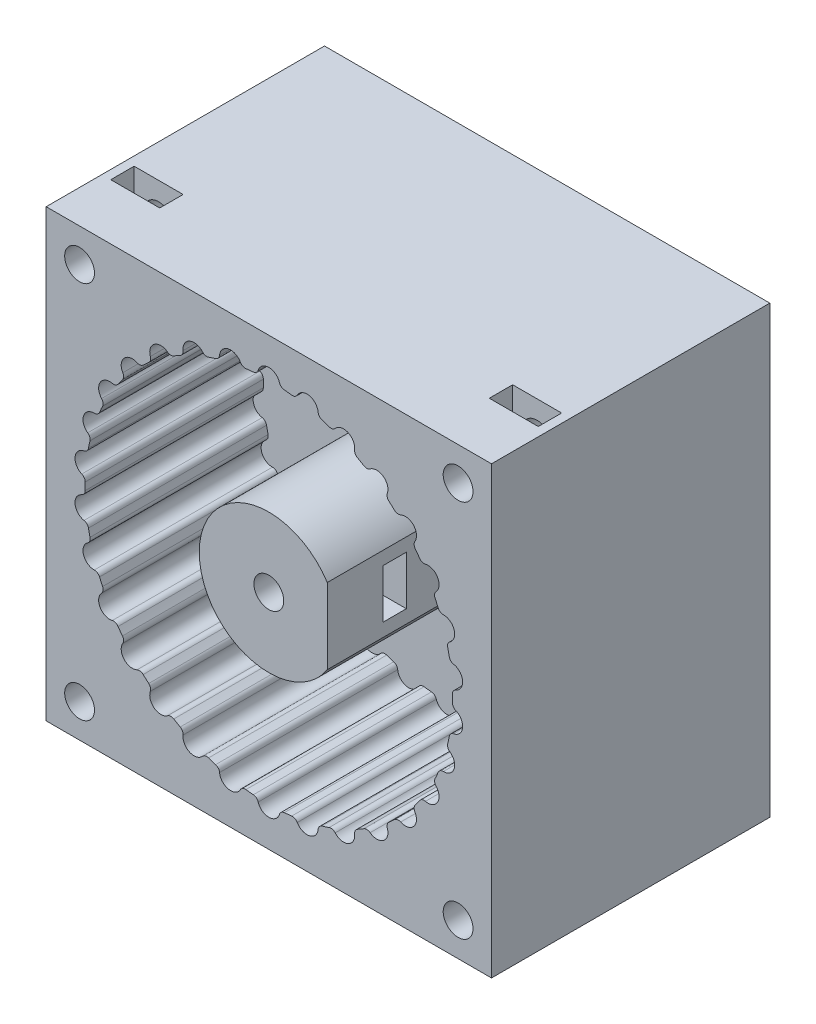
from build123d import *

# Parameters (mm, degrees)
SKETCH1_W                = 50.8
SKETCH1_H                = 50.8
BOSS_EXTRUDE1_DEPTH      = 31.75
CUT_EXTRUDE1_DEPTH       = 20.32
BOSS_EXTRUDE2_DEPTH      = 20.32
M3_CLEARANCE_HOLE1_D     = 3.4
M3_CLEARANCE_HOLE1_DEPTH = 25.4
M3_CLEARANCE_HOLE1_TIP   = 1.021463052
CUT_EXTRUDE2_DEPTH       = 2.667


with BuildPart() as part:
    # Sketch1 → Boss-Extrude1 (new body)
    with BuildSketch(Plane(origin=(0, 0, 0), x_dir=(0, 1, 0), z_dir=(0, 0, 1))):
        Rectangle(SKETCH1_W, SKETCH1_H)
    extrude(amount=BOSS_EXTRUDE1_DEPTH)

    # Sketch2 → Cut-Extrude1 (cut)
    with BuildSketch(Plane.XY.offset(31.75)):
        with BuildLine():
            ThreePointArc((20.950701772, 0.424405759), (21.052431234, 0.782210639), (21.337116454, 1.021642342))
            ThreePointArc((21.337116454, 1.021642342), (22.103249125, 2.323145096), (21.083260653, 3.436918953))
            ThreePointArc((21.083260653, 3.436918953), (20.755015837, 3.611929114), (20.581117591, 3.940764355))
            ThreePointArc((20.581117591, 3.940764355), (20.497082973, 4.356789481), (20.404639753, 4.771027304))
            ThreePointArc((20.404639753, 4.771027304), (20.429754364, 5.142164033), (20.65843788, 5.435552965))
            ThreePointArc((20.65843788, 5.435552965), (21.137231075, 6.8679027), (19.907965193, 7.745270399))
            ThreePointArc((19.907965193, 7.745270399), (19.550506655, 7.848210232), (19.312039812, 8.133704156))
            ThreePointArc((19.312039812, 8.133704156), (19.143345065, 8.523166356), (18.966797065, 8.909132062))
            ThreePointArc((18.966797065, 8.909132062), (18.914199196, 9.277380185), (19.07688644, 9.611903841))
            ThreePointArc((19.07688644, 9.611903841), (19.247414599, 11.1125), (17.862596124, 11.715116361))
            ThreePointArc((17.862596124, 11.715116361), (17.491546519, 11.741486904), (17.198933224, 11.971162056))
            ThreePointArc((17.198933224, 11.971162056), (16.952951117, 12.317039962), (16.700014332, 12.657864998))
            ThreePointArc((16.700014332, 12.657864998), (16.572002763, 13.007130304), (16.661583521, 13.368168395))
            ThreePointArc((16.661583521, 13.368168395), (16.516393746, 14.871427726), (15.036545891, 15.172955524))
            ThreePointArc((15.036545891, 15.172955524), (14.668121865, 15.121604256), (14.334150724, 15.28542273))
            ThreePointArc((14.334150724, 15.28542273), (14.021631856, 15.572599818), (13.703360837, 15.853388495))
            ThreePointArc((13.703360837, 15.853388495), (13.505530288, 16.168406414), (13.518089451, 16.540179844))
            ThreePointArc((13.518089451, 16.540179844), (13.063527232, 17.9804027), (11.553326449, 17.967663722))
            ThreePointArc((11.553326449, 17.967663722), (11.203629901, 17.84083494), (10.842897055, 17.931637083))
            ThreePointArc((10.842897055, 17.931637083), (10.4775, 18.147562336), (10.107804718, 18.356042841))
            ThreePointArc((10.107804718, 18.356042841), (9.848801332, 18.623045579), (9.783790005, 18.989306064))
            ThreePointArc((9.783790005, 18.989306064), (9.039721892, 20.303547796), (7.565171202, 19.977098797))
            ThreePointArc((7.565171202, 19.977098797), (7.249485549, 19.780335528), (6.877756754, 19.79415285))
            ThreePointArc((6.877756754, 19.79415285), (6.475451117, 19.929389299), (6.070489029, 20.056450033))
            ThreePointArc((6.070489029, 20.056450033), (5.761632499, 20.263768289), (5.621891989, 20.608508489))
            ThreePointArc((5.621891989, 20.608508489), (4.620837328, 21.739330426), (3.246381672, 21.113438794))
            ThreePointArc((3.246381672, 21.113438794), (2.978503892, 20.855340536), (2.61202548, 20.791569154))
            ThreePointArc((2.61202548, 20.791569154), (2.190393948, 20.840206317), (1.767863841, 20.880294118))
            ThreePointArc((1.767863841, 20.880294118), (1.422652678, 21.018867089), (1.214290315, 21.327020202))
            ThreePointArc((1.214290315, 21.327020202), (0, 22.225), (-1.214290315, 21.327020202))
            ThreePointArc((-1.214290315, 21.327020202), (-1.422652678, 21.018867089), (-1.767863841, 20.880294118))
            ThreePointArc((-1.767863841, 20.880294118), (-2.190393948, 20.840206317), (-2.61202548, 20.791569154))
            ThreePointArc((-2.61202548, 20.791569154), (-2.978503892, 20.855340536), (-3.246381672, 21.113438794))
            ThreePointArc((-3.246381672, 21.113438794), (-4.620837328, 21.739330426), (-5.621891989, 20.608508489))
            ThreePointArc((-5.621891989, 20.608508489), (-5.761632499, 20.263768289), (-6.070489029, 20.056450033))
            ThreePointArc((-6.070489029, 20.056450033), (-6.475451117, 19.929389299), (-6.877756754, 19.79415285))
            ThreePointArc((-6.877756754, 19.79415285), (-7.249485549, 19.780335528), (-7.565171202, 19.977098797))
            ThreePointArc((-7.565171202, 19.977098797), (-9.039721892, 20.303547796), (-9.783790005, 18.989306064))
            ThreePointArc((-9.783790005, 18.989306064), (-9.848801332, 18.623045579), (-10.107804718, 18.356042841))
            ThreePointArc((-10.107804718, 18.356042841), (-10.4775, 18.147562336), (-10.842897055, 17.931637083))
            ThreePointArc((-10.842897055, 17.931637083), (-11.203629901, 17.84083494), (-11.553326449, 17.967663722))
            ThreePointArc((-11.553326449, 17.967663722), (-13.063527232, 17.9804027), (-13.518089451, 16.540179844))
            ThreePointArc((-13.518089451, 16.540179844), (-13.505530288, 16.168406414), (-13.703360837, 15.853388495))
            ThreePointArc((-13.703360837, 15.853388495), (-14.021631856, 15.572599818), (-14.334150724, 15.28542273))
            ThreePointArc((-14.334150724, 15.28542273), (-14.668121865, 15.121604256), (-15.036545891, 15.172955524))
            ThreePointArc((-15.036545891, 15.172955524), (-16.516393746, 14.871427726), (-16.661583521, 13.368168395))
            ThreePointArc((-16.661583521, 13.368168395), (-16.572002763, 13.007130304), (-16.700014332, 12.657864998))
            ThreePointArc((-16.700014332, 12.657864998), (-16.952951117, 12.317039962), (-17.198933224, 11.971162056))
            ThreePointArc((-17.198933224, 11.971162056), (-17.491546519, 11.741486904), (-17.862596124, 11.715116361))
            ThreePointArc((-17.862596124, 11.715116361), (-19.247414599, 11.1125), (-19.07688644, 9.611903841))
            ThreePointArc((-19.07688644, 9.611903841), (-18.914199196, 9.277380185), (-18.966797065, 8.909132062))
            ThreePointArc((-18.966797065, 8.909132062), (-19.143345065, 8.523166356), (-19.312039812, 8.133704156))
            ThreePointArc((-19.312039812, 8.133704156), (-19.550506655, 7.848210232), (-19.907965193, 7.745270399))
            ThreePointArc((-19.907965193, 7.745270399), (-21.137231075, 6.8679027), (-20.65843788, 5.435552965))
            ThreePointArc((-20.65843788, 5.435552965), (-20.429754364, 5.142164033), (-20.404639753, 4.771027304))
            ThreePointArc((-20.404639753, 4.771027304), (-20.497082973, 4.356789481), (-20.581117591, 3.940764355))
            ThreePointArc((-20.581117591, 3.940764355), (-20.755015837, 3.611929114), (-21.083260653, 3.436918953))
            ThreePointArc((-21.083260653, 3.436918953), (-22.103249125, 2.323145096), (-21.337116454, 1.021642342))
            ThreePointArc((-21.337116454, 1.021642342), (-21.052431234, 0.782210639), (-20.950701772, 0.424405759))
            ThreePointArc((-20.950701772, 0.424405759), (-20.955, 0), (-20.950701772, -0.424405759))
            ThreePointArc((-20.950701772, -0.424405759), (-21.052431234, -0.782210639), (-21.337116454, -1.021642342))
            ThreePointArc((-21.337116454, -1.021642342), (-22.103249125, -2.323145096), (-21.083260653, -3.436918953))
            ThreePointArc((-21.083260653, -3.436918953), (-20.755015837, -3.611929114), (-20.581117591, -3.940764355))
            ThreePointArc((-20.581117591, -3.940764355), (-20.497082973, -4.356789481), (-20.404639753, -4.771027304))
            ThreePointArc((-20.404639753, -4.771027304), (-20.429754364, -5.142164033), (-20.65843788, -5.435552965))
            ThreePointArc((-20.65843788, -5.435552965), (-21.137231075, -6.8679027), (-19.907965193, -7.745270399))
            ThreePointArc((-19.907965193, -7.745270399), (-19.550506655, -7.848210232), (-19.312039812, -8.133704156))
            ThreePointArc((-19.312039812, -8.133704156), (-19.143345065, -8.523166356), (-18.966797065, -8.909132062))
            ThreePointArc((-18.966797065, -8.909132062), (-18.914199196, -9.277380185), (-19.07688644, -9.611903841))
            ThreePointArc((-19.07688644, -9.611903841), (-19.247414599, -11.1125), (-17.862596124, -11.715116361))
            ThreePointArc((-17.862596124, -11.715116361), (-17.491546519, -11.741486904), (-17.198933224, -11.971162056))
            ThreePointArc((-17.198933224, -11.971162056), (-16.952951117, -12.317039962), (-16.700014332, -12.657864998))
            ThreePointArc((-16.700014332, -12.657864998), (-16.572002763, -13.007130304), (-16.661583521, -13.368168395))
            ThreePointArc((-16.661583521, -13.368168395), (-16.516393746, -14.871427726), (-15.036545891, -15.172955524))
            ThreePointArc((-15.036545891, -15.172955524), (-14.668121865, -15.121604256), (-14.334150724, -15.28542273))
            ThreePointArc((-14.334150724, -15.28542273), (-14.021631856, -15.572599818), (-13.703360837, -15.853388495))
            ThreePointArc((-13.703360837, -15.853388495), (-13.505530288, -16.168406414), (-13.518089451, -16.540179844))
            ThreePointArc((-13.518089451, -16.540179844), (-13.063527232, -17.9804027), (-11.553326449, -17.967663722))
            ThreePointArc((-11.553326449, -17.967663722), (-11.203629901, -17.84083494), (-10.842897055, -17.931637083))
            ThreePointArc((-10.842897055, -17.931637083), (-10.4775, -18.147562336), (-10.107804718, -18.356042841))
            ThreePointArc((-10.107804718, -18.356042841), (-9.848801332, -18.623045579), (-9.783790005, -18.989306064))
            ThreePointArc((-9.783790005, -18.989306064), (-9.039721892, -20.303547796), (-7.565171202, -19.977098797))
            ThreePointArc((-7.565171202, -19.977098797), (-7.249485549, -19.780335528), (-6.877756754, -19.79415285))
            ThreePointArc((-6.877756754, -19.79415285), (-6.475451117, -19.929389299), (-6.070489029, -20.056450033))
            ThreePointArc((-6.070489029, -20.056450033), (-5.761632499, -20.263768289), (-5.621891989, -20.608508489))
            ThreePointArc((-5.621891989, -20.608508489), (-4.620837328, -21.739330426), (-3.246381672, -21.113438794))
            ThreePointArc((-3.246381672, -21.113438794), (-2.978503892, -20.855340536), (-2.61202548, -20.791569154))
            ThreePointArc((-2.61202548, -20.791569154), (-2.190393948, -20.840206317), (-1.767863841, -20.880294118))
            ThreePointArc((-1.767863841, -20.880294118), (-1.422652678, -21.018867089), (-1.214290315, -21.327020202))
            ThreePointArc((-1.214290315, -21.327020202), (0, -22.225), (1.214290315, -21.327020202))
            ThreePointArc((1.214290315, -21.327020202), (1.422652678, -21.018867089), (1.767863841, -20.880294118))
            ThreePointArc((1.767863841, -20.880294118), (2.190393948, -20.840206317), (2.61202548, -20.791569154))
            ThreePointArc((2.61202548, -20.791569154), (2.978503892, -20.855340536), (3.246381672, -21.113438794))
            ThreePointArc((3.246381672, -21.113438794), (4.620837328, -21.739330426), (5.621891989, -20.608508489))
            ThreePointArc((5.621891989, -20.608508489), (5.761632499, -20.263768289), (6.070489029, -20.056450033))
            ThreePointArc((6.070489029, -20.056450033), (6.475451117, -19.929389299), (6.877756754, -19.79415285))
            ThreePointArc((6.877756754, -19.79415285), (7.249485549, -19.780335528), (7.565171202, -19.977098797))
            ThreePointArc((7.565171202, -19.977098797), (9.039721892, -20.303547796), (9.783790005, -18.989306064))
            ThreePointArc((9.783790005, -18.989306064), (9.848801332, -18.623045579), (10.107804718, -18.356042841))
            ThreePointArc((10.107804718, -18.356042841), (10.4775, -18.147562336), (10.842897055, -17.931637083))
            ThreePointArc((10.842897055, -17.931637083), (11.203629901, -17.84083494), (11.553326449, -17.967663722))
            ThreePointArc((11.553326449, -17.967663722), (13.063527232, -17.9804027), (13.518089451, -16.540179844))
            ThreePointArc((13.518089451, -16.540179844), (13.505530288, -16.168406414), (13.703360837, -15.853388495))
            ThreePointArc((13.703360837, -15.853388495), (14.021631856, -15.572599818), (14.334150724, -15.28542273))
            ThreePointArc((14.334150724, -15.28542273), (14.668121865, -15.121604256), (15.036545891, -15.172955524))
            ThreePointArc((15.036545891, -15.172955524), (16.516393746, -14.871427726), (16.661583521, -13.368168395))
            ThreePointArc((16.661583521, -13.368168395), (16.572002763, -13.007130304), (16.700014332, -12.657864998))
            ThreePointArc((16.700014332, -12.657864998), (16.952951117, -12.317039962), (17.198933224, -11.971162056))
            ThreePointArc((17.198933224, -11.971162056), (17.491546519, -11.741486904), (17.862596124, -11.715116361))
            ThreePointArc((17.862596124, -11.715116361), (19.247414599, -11.1125), (19.07688644, -9.611903841))
            ThreePointArc((19.07688644, -9.611903841), (18.914199196, -9.277380185), (18.966797065, -8.909132062))
            ThreePointArc((18.966797065, -8.909132062), (19.143345065, -8.523166356), (19.312039812, -8.133704156))
            ThreePointArc((19.312039812, -8.133704156), (19.550506655, -7.848210232), (19.907965193, -7.745270399))
            ThreePointArc((19.907965193, -7.745270399), (21.137231075, -6.8679027), (20.65843788, -5.435552965))
            ThreePointArc((20.65843788, -5.435552965), (20.429754364, -5.142164033), (20.404639753, -4.771027304))
            ThreePointArc((20.404639753, -4.771027304), (20.497082973, -4.356789481), (20.581117591, -3.940764355))
            ThreePointArc((20.581117591, -3.940764355), (20.755015837, -3.611929114), (21.083260653, -3.436918953))
            ThreePointArc((21.083260653, -3.436918953), (22.103249125, -2.323145096), (21.337116454, -1.021642342))
            ThreePointArc((21.337116454, -1.021642342), (21.052431234, -0.782210639), (20.950701772, -0.424405759))
            ThreePointArc((20.950701772, -0.424405759), (20.955, 0), (20.950701772, 0.424405759))
        make_face()
    extrude(amount=-CUT_EXTRUDE1_DEPTH, mode=Mode.SUBTRACT)

    # Sketch3 → Boss-Extrude2 (add)
    with BuildSketch(Plane.XY.offset(11.43)):
        with BuildLine():
            Line((6.6675, 4.306779539), (6.6675, -4.306779539))
            ThreePointArc((6.6675, -4.306779539), (-7.9375, 0), (6.6675, 4.306779539))
        make_face()
    extrude(amount=BOSS_EXTRUDE2_DEPTH)

    # M3 Clearance Hole1
    with Locations(Plane.XY.offset(31.75)):
        with Locations((0, 0), (-21.59, 21.59), (21.59, -21.59), (21.59, 21.59), (-21.59, -21.59)):
            Hole(M3_CLEARANCE_HOLE1_D / 2, depth=M3_CLEARANCE_HOLE1_DEPTH)
            with Locations((0, 0, -(M3_CLEARANCE_HOLE1_DEPTH + M3_CLEARANCE_HOLE1_TIP / 2))):  # 118° drill point
                Cone(0, M3_CLEARANCE_HOLE1_D / 2, M3_CLEARANCE_HOLE1_TIP, mode=Mode.SUBTRACT)

    # Sketch6 → Cut-Extrude2 (cut)
    with BuildSketch(Plane(origin=(0, 0, 25.4), x_dir=(0, 1, 0), z_dir=(0, 0, 1))):
        Polygon((25.4, 24.384), (25.4, 18.796), (23.203116652, 18.796), (24.816233304, 21.59), (23.203116652, 24.384), align=None)
        Polygon((23.203116652, 24.384), (23.203116652, 18.796), (19.976883348, 18.796), (18.363766696, 21.59), (19.976883348, 24.384), align=None)
        Polygon((23.203116652, -18.796), (23.203116652, -24.384), (19.976883348, -24.384), (18.363766696, -21.59), (19.976883348, -18.796), align=None)
        Polygon((25.4, -18.796), (25.4, -24.384), (23.203116652, -24.384), (24.816233304, -21.59), (23.203116652, -18.796), align=None)
        Polygon((-23.203116652, -18.796), (-25.4, -18.796), (-25.4, -24.384), (-23.203116652, -24.384), (-24.816233304, -21.59), align=None)
        Polygon((-19.976883348, -18.796), (-23.203116652, -18.796), (-23.203116652, -24.384), (-19.976883348, -24.384), (-18.363766696, -21.59), align=None)
        Polygon((-23.203116652, -18.796), (-23.203116652, -24.384), (-24.816233304, -21.59), align=None)
        Polygon((24.816233304, -21.59), (23.203116652, -18.796), (23.203116652, -24.384), align=None)
        Polygon((24.816233304, 21.59), (23.203116652, 24.384), (23.203116652, 18.796), align=None)
        Polygon((-19.976883348, 24.384), (-23.203116652, 24.384), (-23.203116652, 18.796), (-19.976883348, 18.796), (-18.363766696, 21.59), align=None)
        Polygon((-23.203116652, 24.384), (-23.203116652, 18.796), (-24.816233304, 21.59), align=None)
        Polygon((-23.203116652, 24.384), (-25.4, 24.384), (-25.4, 18.796), (-23.203116652, 18.796), (-24.816233304, 21.59), align=None)
        Polygon((-2.794, 1.613116652), (-2.794, -1.613116652), (2.794, -1.613116652), (2.794, 1.613116652), (0, 3.226233304), align=None)
        Polygon((-2.794, -1.613116652), (2.794, -1.613116652), (0, -3.226233304), align=None)
        Polygon((2.794, -1.613116652), (2.794, -6.6675), (-2.794, -6.6675), (-2.794, -1.613116652), (0, -3.226233304), align=None)
    extrude(amount=-CUT_EXTRUDE2_DEPTH, mode=Mode.SUBTRACT)


solid = part.part
